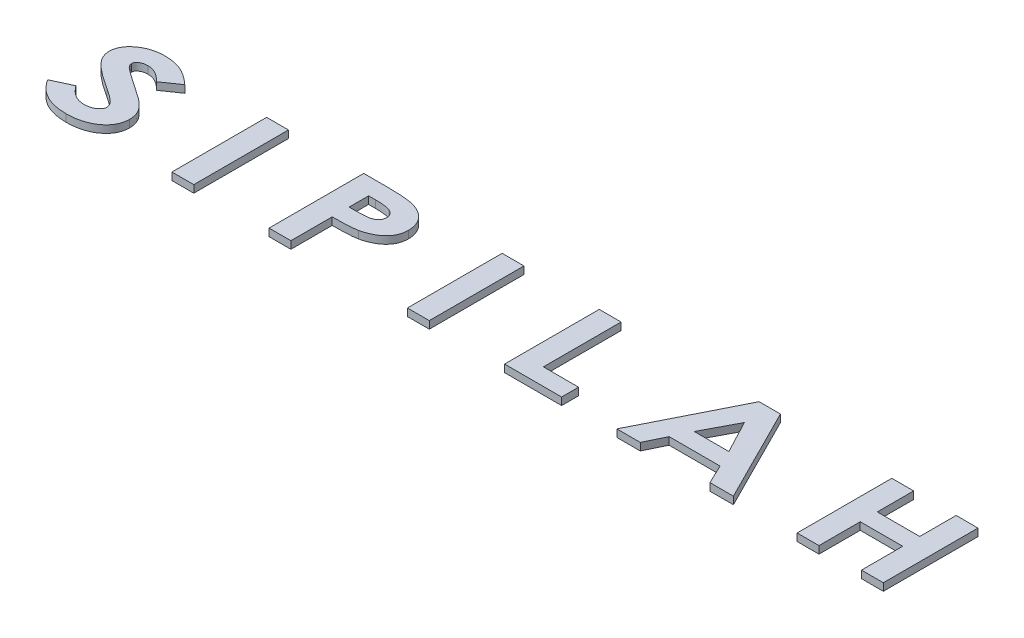
from build123d import *

# Parameters (mm, degrees)
BOSS_EXTRUDE1_DEPTH   = 0.5
SKETCH1_W             = 1.465384615
SKETCH1_H             = 6.35
BOSS_EXTRUDE1_2_DEPTH = 0.5
BOSS_EXTRUDE1_3_DEPTH = 0.5
SKETCH1_W_2           = 1.465384616
BOSS_EXTRUDE1_4_DEPTH = 0.5
BOSS_EXTRUDE1_5_DEPTH = 0.5
BOSS_EXTRUDE1_6_DEPTH = 0.5
BOSS_EXTRUDE1_7_DEPTH = 0.5


with BuildPart() as part:
    # Sketch1 → Boss-Extrude1 (new body)
    with BuildSketch(Plane(origin=(0, 0, 0), x_dir=(1, 0, 0), z_dir=(0, 1, 0))):
        with BuildLine():
            Line((-24.95224359, 5.501552484), (-26.077994792, 4.721794872))
            add(Edge.make_bspline(
                [(-26.077994792, 4.721794872), (-26.126867181, 4.77341703), (-26.22138768, 4.873255653), (-26.370858266, 5.00634683), (-26.521046103, 5.118801015), (-26.671834014, 5.211634336), (-26.824023206, 5.283787465), (-26.977326307, 5.334825994), (-27.13116572, 5.367093963), (-27.234124527, 5.371094199), (-27.28515625, 5.373076923)],
                knots=[0, 0, 0, 0, 1.207669291, 2.335664454, 3.396356464, 4.392421051, 5.340108823, 6.251573568, 7.133389213, 8, 8, 8, 8], degree=3))
            add(Edge.make_bspline(
                [(-27.28515625, 5.373076923), (-27.332752058, 5.37182179), (-27.424376519, 5.369405591), (-27.555222356, 5.345178216), (-27.672424146, 5.304477756), (-27.773875926, 5.24921673), (-27.855689488, 5.18371315), (-27.919072136, 5.114518451), (-27.95755553, 5.03737225), (-27.96217815, 4.983354535), (-27.964423077, 4.957121394)],
                knots=[0, 0, 0, 0, 1.308994644, 2.519884291, 3.645670017, 4.711226319, 5.682704006, 6.518200215, 7.28037937, 8, 8, 8, 8], degree=3))
            add(Edge.make_bspline(
                [(-27.964423077, 4.957121394), (-27.962566476, 4.930639589), (-27.958799681, 4.876911536), (-27.931897703, 4.797948602), (-27.887799034, 4.721809256), (-27.847837747, 4.676619935), (-27.827043269, 4.653104968)],
                knots=[0, 0, 0, 0, 0.929301116, 1.885428076, 2.899649557, 4, 4, 4, 4], degree=3))
            add(Edge.make_bspline(
                [(-27.827043269, 4.653104968), (-27.807771416, 4.634608672), (-27.763067373, 4.591703655), (-27.679891404, 4.525371126), (-27.576296565, 4.441508269), (-27.445918849, 4.348134283), (-27.29496407, 4.237406064), (-27.118384803, 4.116492938), (-26.920760949, 3.978163963), (-26.779498307, 3.883673671), (-26.705108173, 3.833914263)],
                knots=[0, 0, 0, 0, 0.460866546, 1.069051162, 1.834896047, 2.761527, 3.83612926, 5.066510405, 6.455198905, 8, 8, 8, 8], degree=3))
            add(Edge.make_bspline(
                [(-26.705108173, 3.833914263), (-26.635524934, 3.787765091), (-26.503806556, 3.700406494), (-26.317308494, 3.575217166), (-26.152538873, 3.463450768), (-26.008280631, 3.365827462), (-25.886574596, 3.280426572), (-25.7855597, 3.209491191), (-25.70675751, 3.151261014), (-25.661979322, 3.116140303), (-25.642958734, 3.101221955)],
                knots=[0, 0, 0, 0, 1.552684983, 2.939172589, 4.176976497, 5.255162841, 6.178235249, 6.941768944, 7.550491478, 8, 8, 8, 8], degree=3))
            add(Edge.make_bspline(
                [(-25.642958734, 3.101221955), (-25.570344293, 3.040816638), (-25.432013114, 2.925743952), (-25.249732835, 2.745069024), (-25.099554134, 2.569042054), (-24.98233603, 2.393762233), (-24.895547209, 2.215893309), (-24.832945907, 2.032842193), (-24.797343182, 1.841168341), (-24.792078678, 1.710603223), (-24.789423077, 1.644741587)],
                knots=[0, 0, 0, 0, 1.292881224, 2.462950635, 3.509647133, 4.456510364, 5.341962874, 6.212247473, 7.098194766, 8, 8, 8, 8], degree=3))
            add(Edge.make_bspline(
                [(-24.789423077, 1.644741587), (-24.791056919, 1.58055274), (-24.794271839, 1.454248022), (-24.8293698, 1.269522283), (-24.882196401, 1.093424845), (-24.956751959, 0.925411225), (-25.054948919, 0.767573137), (-25.171907402, 0.616322947), (-25.312811617, 0.476040825), (-25.47198288, 0.344719783), (-25.648708751, 0.225390232), (-25.839867026, 0.120929102), (-26.044014685, 0.033293429), (-26.261106565, -0.038409247), (-26.490984657, -0.093566327), (-26.733597446, -0.134410724), (-26.989109718, -0.158978479), (-27.163833685, -0.161518901), (-27.253355369, -0.162820513)],
                knots=[0, 0, 0, 0, 0.902957558, 1.77675416, 2.638138365, 3.488188074, 4.356663338, 5.250152695, 6.174883614, 7.150484739, 8.152501359, 9.173326986, 10.213821441, 11.276962312, 12.389277065, 13.539836655, 14.739509126, 16, 16, 16, 16], degree=3))
            add(Edge.make_bspline(
                [(-27.253355369, -0.162820513), (-27.323769941, -0.161880639), (-27.462224845, -0.160032581), (-27.666463255, -0.14433094), (-27.86393404, -0.119091709), (-28.054706005, -0.083708665), (-28.238610853, -0.037718922), (-28.415497694, 0.017948978), (-28.585357334, 0.084521742), (-28.748892533, 0.160747924), (-28.905775071, 0.248787516), (-29.056376407, 0.348683801), (-29.201563579, 0.45927185), (-29.340934634, 0.582170496), (-29.473868231, 0.716915396), (-29.60186683, 0.862889269), (-29.724191138, 1.020239879), (-29.79896333, 1.132472052), (-29.836858974, 1.189352965)],
                knots=[0, 0, 0, 0, 1.105273542, 2.173279444, 3.213565855, 4.229263474, 5.217276341, 6.187756421, 7.138309119, 8.079281442, 9.018038101, 9.95957529, 10.914128178, 11.880948991, 12.874083274, 13.883479761, 14.927316466, 16, 16, 16, 16], degree=3))
            Line((-29.836858974, 1.189352965), (-28.539383013, 1.791025641))
            add(Edge.make_bspline(
                [(-28.539383013, 1.791025641), (-28.491010797, 1.726399684), (-28.397305842, 1.601208553), (-28.241040841, 1.436191506), (-28.081699227, 1.29336933), (-27.914469175, 1.178982892), (-27.742462695, 1.08780558), (-27.564280967, 1.024150206), (-27.380640472, 0.984118196), (-27.256100178, 0.979328125), (-27.193569712, 0.976923077)],
                knots=[0, 0, 0, 0, 1.183126636, 2.291911316, 3.327479545, 4.315960281, 5.256209658, 6.174923512, 7.083646907, 8, 8, 8, 8], degree=3))
            add(Edge.make_bspline(
                [(-27.193569712, 0.976923077), (-27.129784204, 0.978917697), (-27.006310739, 0.982778805), (-26.829593521, 1.018203419), (-26.667565562, 1.07308548), (-26.527154881, 1.153516706), (-26.408560466, 1.245175545), (-26.320564642, 1.34787616), (-26.264080806, 1.460199675), (-26.25787628, 1.539417032), (-26.254807692, 1.578595753)],
                knots=[0, 0, 0, 0, 1.250982055, 2.421601618, 3.52480127, 4.59457637, 5.583980509, 6.452687854, 7.234742052, 8, 8, 8, 8], degree=3))
            add(Edge.make_bspline(
                [(-26.254807692, 1.578595753), (-26.257338923, 1.614970613), (-26.262536028, 1.689655214), (-26.304313331, 1.799458622), (-26.36775234, 1.909282791), (-26.442325385, 1.998408893), (-26.518982597, 2.07221422), (-26.591929629, 2.13770002), (-26.680877247, 2.209544356), (-26.785655263, 2.288293289), (-26.905212825, 2.374248849), (-27.038766652, 2.4692317), (-27.189253924, 2.569003827), (-27.294861113, 2.637851996), (-27.350030048, 2.673818109)],
                knots=[0, 0, 0, 0, 0.815327801, 1.67402515, 2.608680218, 3.657665297, 4.270694342, 4.999323204, 5.859287847, 6.838608332, 7.943834011, 9.167558269, 10.52033944, 12, 12, 12, 12], degree=3))
            add(Edge.make_bspline(
                [(-27.350030048, 2.673818109), (-27.454974796, 2.742183588), (-27.656094777, 2.873201712), (-27.941471538, 3.066444285), (-28.197450872, 3.248076946), (-28.42397122, 3.418185567), (-28.621418859, 3.576240675), (-28.791654643, 3.719851644), (-28.930704484, 3.853933077), (-29.045089582, 3.976863591), (-29.136561428, 4.095461965), (-29.215840758, 4.21016909), (-29.279662684, 4.326574537), (-29.336040954, 4.441136329), (-29.377768119, 4.556843188), (-29.407167675, 4.672324498), (-29.425828411, 4.787337499), (-29.428485877, 4.864195148), (-29.429807692, 4.902423878)],
                knots=[0, 0, 0, 0, 1.89919295, 3.639683364, 5.225705325, 6.658205857, 7.934446372, 9.060714954, 10.033806128, 10.862042785, 11.604144816, 12.303191233, 12.973898893, 13.615209792, 14.237579864, 14.834833964, 15.420450427, 16, 16, 16, 16], degree=3))
            add(Edge.make_bspline(
                [(-29.429807692, 4.902423878), (-29.427844302, 4.956842851), (-29.423965253, 5.064357839), (-29.393195432, 5.222335649), (-29.345699514, 5.375286622), (-29.273978466, 5.520379013), (-29.185624745, 5.660852535), (-29.076558092, 5.794293272), (-28.948432358, 5.922305492), (-28.801588991, 6.041435988), (-28.641069186, 6.151693254), (-28.469196141, 6.248579127), (-28.287541959, 6.329882371), (-28.097590514, 6.397751793), (-27.89836914, 6.449797891), (-27.689947326, 6.486611404), (-27.472181916, 6.508269124), (-27.323790034, 6.511285403), (-27.248267228, 6.512820513)],
                knots=[0, 0, 0, 0, 0.869527605, 1.71791649, 2.564868322, 3.423034978, 4.29767548, 5.213596993, 6.172427456, 7.188991251, 8.232708049, 9.283076077, 10.339096273, 11.411315699, 12.504907975, 13.627395035, 14.792482552, 16, 16, 16, 16], degree=3))
            add(Edge.make_bspline(
                [(-27.248267228, 6.512820513), (-27.150176117, 6.510098782), (-26.955689499, 6.504702368), (-26.668170917, 6.462489609), (-26.387692362, 6.395274099), (-26.159665262, 6.315111978), (-25.978458415, 6.235954152), (-25.839623114, 6.164419519), (-25.698649703, 6.080755392), (-25.553008787, 5.9889468), (-25.407372987, 5.881793697), (-25.256858193, 5.76657005), (-25.104144912, 5.639187678), (-25.003651959, 5.548132729), (-24.95224359, 5.501552484)],
                knots=[0, 0, 0, 0, 1.370666987, 2.717640612, 4.053103165, 5.397100452, 6.08976297, 6.816069123, 7.578454649, 8.38077928, 9.221355996, 10.104544732, 11.030357245, 12, 12, 12, 12], degree=3))
        make_face()
    extrude(amount=BOSS_EXTRUDE1_DEPTH)


with BuildPart() as body_2:
    # Sketch1 → Boss-Extrude1 2 (new body)
    with BuildSketch(Plane(origin=(0, 0, 0), x_dir=(1, 0, 0), z_dir=(0, 1, 0))):
        with Locations((-19.579166667, 3.175)):
            Rectangle(SKETCH1_W, SKETCH1_H)
    extrude(amount=BOSS_EXTRUDE1_2_DEPTH)


with BuildPart() as body_3:
    # Sketch1 → Boss-Extrude1 3 (new body)
    with BuildSketch(Plane(origin=(0, 0, 0), x_dir=(1, 0, 0), z_dir=(0, 1, 0))):
        with BuildLine():
            Line((-13.799038462, 6.35), (-12.167017228, 6.35))
            add(Edge.make_bspline(
                [(-12.167017228, 6.35), (-12.060584758, 6.349631943), (-11.855310986, 6.348922081), (-11.558819967, 6.340157921), (-11.285294102, 6.324685117), (-11.034880368, 6.305363393), (-10.8075607, 6.278231859), (-10.603169358, 6.247561327), (-10.421678943, 6.209819142), (-10.261084796, 6.164880262), (-10.116322141, 6.112496969), (-9.980329375, 6.056156562), (-9.853965396, 5.988937456), (-9.732821923, 5.918416329), (-9.621449282, 5.83805414), (-9.517513824, 5.750667938), (-9.42056936, 5.657042018), (-9.332899173, 5.554952012), (-9.254415336, 5.44721271), (-9.184655835, 5.334496466), (-9.126423274, 5.215893889), (-9.07765743, 5.092295879), (-9.040530899, 4.963221803), (-9.015985218, 4.82849715), (-8.998252545, 4.689189466), (-8.996645255, 4.594225167), (-8.995833333, 4.546254006)],
                knots=[0, 0, 0, 0, 1.855107689, 3.577902052, 5.169361155, 6.630109933, 7.954766161, 9.158917748, 10.231552938, 11.183798028, 12.062755255, 12.913834021, 13.746847176, 14.555505333, 15.355368483, 16.136995589, 16.920960237, 17.701748312, 18.479311714, 19.242374405, 20.009185935, 20.77912529, 21.55573978, 22.345708185, 23.164335441, 24, 24, 24, 24], degree=3))
            add(Edge.make_bspline(
                [(-8.995833333, 4.546254006), (-8.99749565, 4.493198443), (-9.000766063, 4.388817886), (-9.020716206, 4.235597445), (-9.056866566, 4.08953302), (-9.106610469, 3.950103813), (-9.170308997, 3.817353961), (-9.248645458, 3.691412053), (-9.341859817, 3.573464926), (-9.448267949, 3.462284791), (-9.566080852, 3.358944999), (-9.693973767, 3.262403987), (-9.833380055, 3.176369282), (-9.982277858, 3.097708712), (-10.14100244, 3.025896604), (-10.309758988, 2.962886953), (-10.488837843, 2.907292853), (-10.612798668, 2.879061061), (-10.676191907, 2.864623397)],
                knots=[0, 0, 0, 0, 0.983245981, 1.934420402, 2.856730671, 3.766303004, 4.672952299, 5.579907935, 6.508820747, 7.45354822, 8.427711485, 9.40982672, 10.419219512, 11.459572099, 12.528575546, 13.644949869, 14.795633565, 16, 16, 16, 16], degree=3))
            add(Edge.make_bspline(
                [(-10.676191907, 2.864623397), (-10.718092805, 2.856516219), (-10.809112961, 2.838905222), (-10.958358654, 2.821262706), (-11.130534371, 2.804686166), (-11.326050849, 2.790723643), (-11.544932508, 2.781176578), (-11.787062473, 2.773646876), (-12.05251014, 2.768246486), (-12.237400253, 2.768050663), (-12.333653846, 2.767948718)],
                knots=[0, 0, 0, 0, 0.615940763, 1.337991025, 2.168184893, 3.113261968, 4.167258378, 5.33087916, 6.610458565, 8, 8, 8, 8], degree=3))
            Line((-12.333653846, 2.767948718), (-12.333653846, 0))
            Line((-12.333653846, 0), (-13.799038462, 0))
            Line((-13.799038462, 0), (-13.799038462, 6.35))
        make_face()
        with BuildLine():
            Line((-12.333653846, 3.907692308), (-11.817207532, 3.907692308))
            add(Edge.make_bspline(
                [(-11.817207532, 3.907692308), (-11.768445317, 3.908036154), (-11.674730761, 3.908696981), (-11.539866704, 3.910926538), (-11.416838763, 3.915685062), (-11.305370838, 3.923869455), (-11.205540661, 3.93179), (-11.117014912, 3.943930102), (-11.039905896, 3.955534554), (-10.953984982, 3.975967928), (-10.859942869, 4.007239458), (-10.75918234, 4.05625591), (-10.670529903, 4.114301237), (-10.595735876, 4.183943391), (-10.535100388, 4.2625379), (-10.492729976, 4.351026139), (-10.466231373, 4.44678822), (-10.462914802, 4.513430115), (-10.461217949, 4.547526042)],
                knots=[0, 0, 0, 0, 1.392285696, 2.675789788, 3.851106149, 4.906862521, 5.867013269, 6.709429052, 7.457775361, 8.092061581, 9.229094434, 10.279492485, 11.283446023, 12.242833232, 13.184721612, 14.099774538, 15.027789537, 16, 16, 16, 16], degree=3))
            add(Edge.make_bspline(
                [(-10.461217949, 4.547526042), (-10.462456918, 4.57730163), (-10.46486975, 4.635288155), (-10.483155124, 4.718952894), (-10.512710997, 4.796802505), (-10.554678799, 4.868727103), (-10.610683904, 4.932346735), (-10.676853454, 4.99052392), (-10.754577546, 5.043387603), (-10.813530985, 5.070345985), (-10.844100561, 5.08432492)],
                knots=[0, 0, 0, 0, 1.01607562, 1.978758329, 2.909106172, 3.850207249, 4.805018697, 5.789768104, 6.853911621, 8, 8, 8, 8], degree=3))
            add(Edge.make_bspline(
                [(-10.844100561, 5.08432492), (-10.869798474, 5.094564235), (-10.924952544, 5.116540335), (-11.017606701, 5.141124146), (-11.124266513, 5.162394673), (-11.245722093, 5.180008185), (-11.381964687, 5.193604962), (-11.533397786, 5.20401735), (-11.699734832, 5.208181914), (-11.81551112, 5.209546665), (-11.875721154, 5.21025641)],
                knots=[0, 0, 0, 0, 0.634816011, 1.362472005, 2.197016134, 3.132082461, 4.179500588, 5.340894497, 6.617118958, 8, 8, 8, 8], degree=3))
            Line((-11.875721154, 5.21025641), (-12.333653846, 5.21025641))
            Line((-12.333653846, 5.21025641), (-12.333653846, 3.907692308))
        make_face(mode=Mode.SUBTRACT)
    extrude(amount=BOSS_EXTRUDE1_3_DEPTH)


with BuildPart() as body_4:
    # Sketch1 → Boss-Extrude1 4 (new body)
    with BuildSketch(Plane(origin=(0, 0, 0), x_dir=(1, 0, 0), z_dir=(0, 1, 0))):
        with Locations((-3.785576923, 3.175)):
            Rectangle(SKETCH1_W_2, SKETCH1_H)
    extrude(amount=BOSS_EXTRUDE1_4_DEPTH)


with BuildPart() as body_5:
    # Sketch1 → Boss-Extrude1 5 (new body)
    with BuildSketch(Plane(origin=(0, 0, 0), x_dir=(1, 0, 0), z_dir=(0, 1, 0))):
        Polygon((1.994551282, 6.35), (3.459935897, 6.35), (3.459935897, 1.13974359), (5.820833333, 1.13974359), (5.820833333, 0), (1.994551282, 0), align=None)
    extrude(amount=BOSS_EXTRUDE1_5_DEPTH)


with BuildPart() as body_6:
    # Sketch1 → Boss-Extrude1 6 (new body)
    with BuildSketch(Plane(origin=(0, 0, 0), x_dir=(1, 0, 0), z_dir=(0, 1, 0))):
        Polygon((12.715264423, 6.35), (14.146304087, 6.35), (17.340384615, 0), (15.769421074, 0), (15.142307692, 1.302564103), (11.724348958, 1.302564103), (11.097235577, 0), (9.525, 0), align=None)
        Polygon((13.432692308, 4.646744792), (12.272596154, 2.442307692), (14.595332532, 2.442307692), align=None, mode=Mode.SUBTRACT)
    extrude(amount=BOSS_EXTRUDE1_6_DEPTH)


with BuildPart() as body_7:
    # Sketch1 → Boss-Extrude1 7 (new body)
    with BuildSketch(Plane(origin=(0, 0, 0), x_dir=(1, 0, 0), z_dir=(0, 1, 0))):
        Polygon((21.614423077, 6.35), (23.079807692, 6.35), (23.079807692, 3.907692308), (25.929166667, 3.907692308), (25.929166667, 6.35), (27.394551282, 6.35), (27.394551282, 0), (25.929166667, 0), (25.929166667, 2.767948718), (23.079807692, 2.767948718), (23.079807692, 0), (21.614423077, 0), align=None)
    extrude(amount=BOSS_EXTRUDE1_7_DEPTH)


solid = Compound([part.part, body_2.part, body_3.part, body_4.part, body_5.part, body_6.part, body_7.part])
